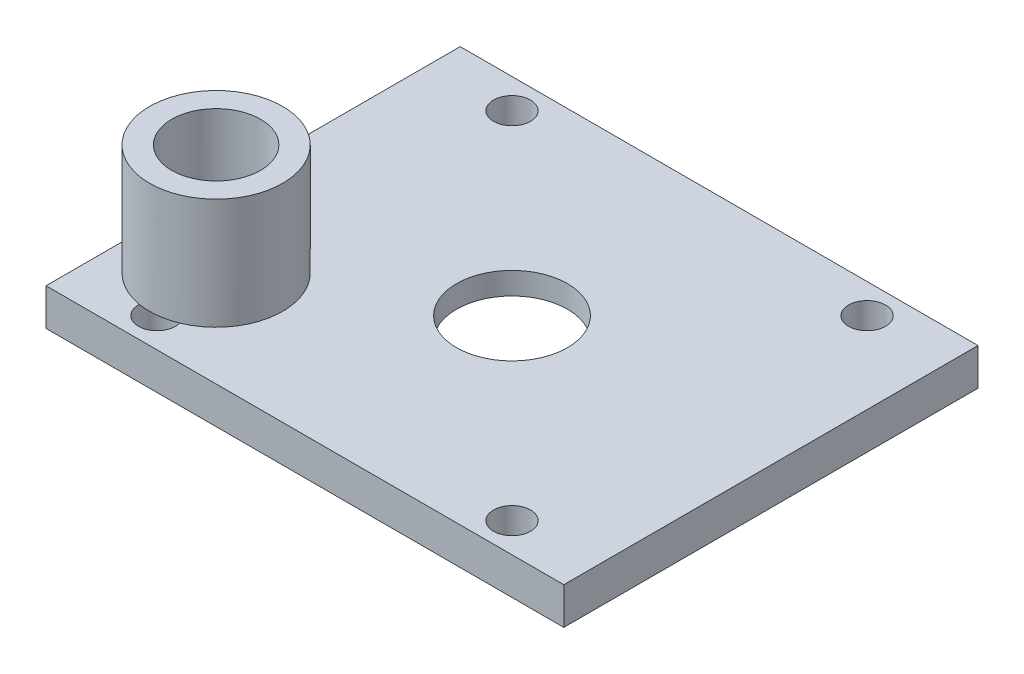
from build123d import *

# Parameters (mm, degrees)
SKETCH1_W               = 70
SKETCH1_H               = 56
BOSS_EXTRUDE1_DEPTH     = 5
SKETCH2_R               = 9
BOSS_EXTRUDE2_DEPTH     = 15
SKETCH4_R               = 19
CUT_EXTRUDE2_DEPTH      = 2
CUT_EXTRUDE3_DEPTH      = 49.301138703
CUT_EXTRUDE3_DEPTH_BACK = 49.301138703
SKETCH5_R               = 7.5
SKETCH6_R               = 6
CUT_EXTRUDE4_DEPTH      = 15
SKETCH7_R               = 2.5
CUT_EXTRUDE5_DEPTH      = 48.265209192


with BuildPart() as part:
    # Sketch1 → Boss-Extrude1 (new body)
    with BuildSketch(Plane(origin=(0, 0, 0), x_dir=(1, 0, 0), z_dir=(0, 1, 0))):
        Rectangle(SKETCH1_W, SKETCH1_H)
    extrude(amount=BOSS_EXTRUDE1_DEPTH)

    # Sketch2 → Boss-Extrude2 (add)
    with BuildSketch(Plane(origin=(0, 5, 0), x_dir=(1, 0, 0), z_dir=(0, 1, 0))):
        with Locations(Location((-25, -15, 0), (0, 0, 90))):
            Circle(SKETCH2_R)
    extrude(amount=BOSS_EXTRUDE2_DEPTH)

    # Sketch4 → Cut-Extrude2 (cut)
    with BuildSketch(Plane.XZ):
        with Locations(Location((0, 0, 0), (0, 0, 270))):
            Circle(SKETCH4_R)
    extrude(amount=-CUT_EXTRUDE2_DEPTH, mode=Mode.SUBTRACT)

    # Sketch5 → Cut-Extrude3 (cut, two sides: drawn at the far end of the back side and taken through both)
    with BuildSketch(Plane.XZ.offset(-2).offset(-CUT_EXTRUDE3_DEPTH_BACK)):
        with Locations(Location((0, 0, 0), (0, 0, 270))):
            Circle(SKETCH5_R)
    extrude(amount=CUT_EXTRUDE3_DEPTH + CUT_EXTRUDE3_DEPTH_BACK, mode=Mode.SUBTRACT)

    # Sketch6 → Cut-Extrude4 (cut)
    with BuildSketch(Plane(origin=(0, 20, 0), x_dir=(1, 0, 0), z_dir=(0, 1, 0))):
        with Locations(Location((-25, -15, 0), (0, 0, 270))):
            Circle(SKETCH6_R)
    extrude(amount=-CUT_EXTRUDE4_DEPTH, mode=Mode.SUBTRACT)

    # Sketch7 → Cut-Extrude5 (cut, through all)
    with BuildSketch(Plane(origin=(0, 5, 0), x_dir=(1, 0, 0), z_dir=(0, 1, 0))):
        with Locations(Location((-24, 24, 0), (0, 0, 270))):
            Circle(SKETCH7_R)
        with Locations(Location((24, 24, 0), (0, 0, 270))):
            Circle(SKETCH7_R)
        with Locations(Location((24, -24, 0), (0, 0, 270))):
            Circle(SKETCH7_R)
        with Locations(Location((-24, -24, 0), (0, 0, 270))):
            Circle(SKETCH7_R)
    extrude(amount=-CUT_EXTRUDE5_DEPTH, mode=Mode.SUBTRACT)


solid = part.part
